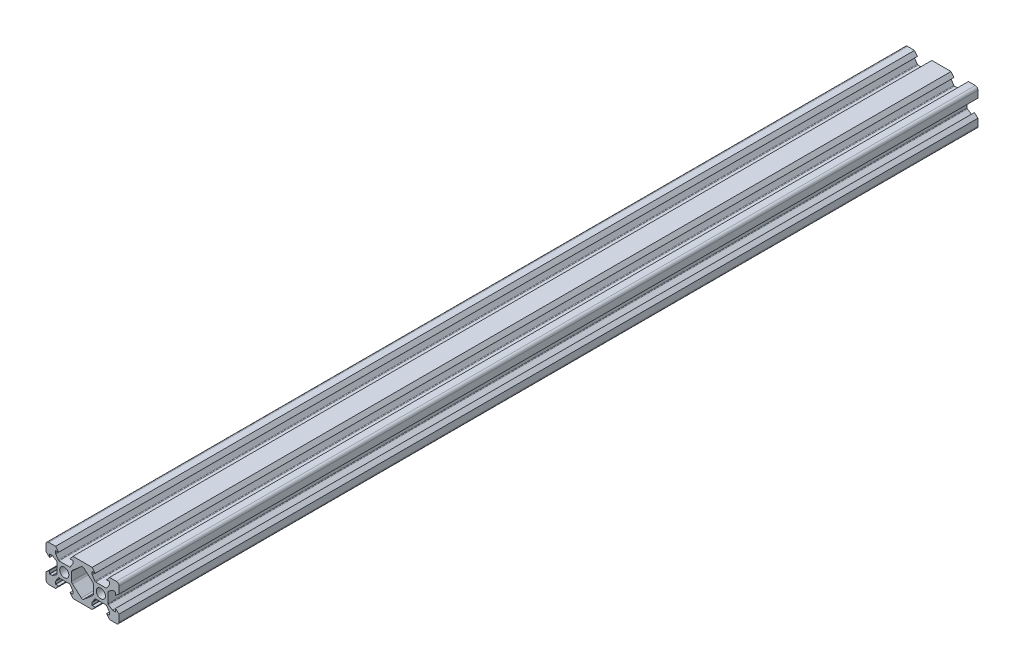
from build123d import *

# Parameters (mm, degrees)
SKETCH_1_R      = 2.5
EXTRUDE_1_DEPTH = 470


with BuildPart() as part:
    # Эскиз1 → Бобышка-Вытянуть1 (new body)
    with BuildSketch(Plane.XY):
        with BuildLine():
            Line((-18.5, 14.076873633), (-14.75, 14.076873633))
            Line((-14.75, 14.076873633), (-13.1, 12.076873633))
            Line((-13.1, 12.076873633), (-14.65, 12.076873633))
            ThreePointArc((-14.65, 12.076873633), (-14.720710678, 12.047584311), (-14.75, 11.976873633))
            Line((-14.75, 11.976873633), (-14.75, 10.726998833))
            ThreePointArc((-14.75, 10.726998833), (-14.728880127, 10.583214884), (-14.667304703, 10.451577729))
            Line((-14.667304703, 10.451577729), (-13.248222071, 8.301452529))
            ThreePointArc((-13.248222071, 8.301452529), (-13.067866147, 8.136583642), (-12.830917368, 8.076873633))
            Line((-12.830917368, 8.076873633), (-7.169082632, 8.076873633))
            ThreePointArc((-7.169082632, 8.076873633), (-6.932133853, 8.136583642), (-6.751777929, 8.301452529))
            Line((-6.751777929, 8.301452529), (-5.332695297, 10.451577729))
            ThreePointArc((-5.332695297, 10.451577729), (-5.271119873, 10.583214884), (-5.25, 10.726998833))
            Line((-5.25, 10.726998833), (-5.25, 11.976873633))
            ThreePointArc((-5.25, 11.976873633), (-5.279289322, 12.047584311), (-5.35, 12.076873633))
            Line((-5.35, 12.076873633), (-6.9, 12.076873633))
            Line((-6.9, 12.076873633), (-5.25, 14.076873633))
            Line((-5.25, 14.076873633), (5.25, 14.076873633))
            Line((5.25, 14.076873633), (6.9, 12.076873633))
            Line((6.9, 12.076873633), (5.35, 12.076873633))
            ThreePointArc((5.35, 12.076873633), (5.279289322, 12.047584311), (5.25, 11.976873633))
            Line((5.25, 11.976873633), (5.25, 10.726998833))
            ThreePointArc((5.25, 10.726998833), (5.271119873, 10.583214884), (5.332695297, 10.451577729))
            Line((5.332695297, 10.451577729), (6.751777929, 8.301452529))
            ThreePointArc((6.751777929, 8.301452529), (6.932133853, 8.136583642), (7.169082632, 8.076873633))
            Line((7.169082632, 8.076873633), (12.830917368, 8.076873633))
            ThreePointArc((12.830917368, 8.076873633), (13.067866147, 8.136583642), (13.248222071, 8.301452529))
            Line((13.248222071, 8.301452529), (14.667304703, 10.451577729))
            ThreePointArc((14.667304703, 10.451577729), (14.728880127, 10.583214884), (14.75, 10.726998833))
            Line((14.75, 10.726998833), (14.75, 11.976873633))
            ThreePointArc((14.75, 11.976873633), (14.720710678, 12.047584311), (14.65, 12.076873633))
            Line((14.65, 12.076873633), (13.1, 12.076873633))
            Line((13.1, 12.076873633), (14.75, 14.076873633))
            Line((14.75, 14.076873633), (18.5, 14.076873633))
            ThreePointArc((18.5, 14.076873633), (19.560660172, 13.637533805), (20, 12.576873633))
            Line((20, 12.576873633), (20, 8.826873633))
            Line((20, 8.826873633), (18, 7.176873633))
            Line((18, 7.176873633), (18, 8.726873633))
            ThreePointArc((18, 8.726873633), (17.970710678, 8.797584311), (17.9, 8.826873633))
            Line((17.9, 8.826873633), (16.6501252, 8.826873633))
            ThreePointArc((16.6501252, 8.826873633), (16.50634125, 8.80575376), (16.374704096, 8.744178337))
            Line((16.374704096, 8.744178337), (14.224578896, 7.325095704))
            ThreePointArc((14.224578896, 7.325095704), (14.059710009, 7.14473978), (14, 6.907791001))
            Line((14, 6.907791001), (14, 1.245956265))
            ThreePointArc((14, 1.245956265), (14.059710009, 1.009007486), (14.224578896, 0.828651562))
            Line((14.224578896, 0.828651562), (16.374704096, -0.59043107))
            ThreePointArc((16.374704096, -0.59043107), (16.50634125, -0.652006494), (16.6501252, -0.673126367))
            Line((16.6501252, -0.673126367), (17.9, -0.673126367))
            ThreePointArc((17.9, -0.673126367), (17.970710678, -0.643837045), (18, -0.573126367))
            Line((18, -0.573126367), (18, 0.976873633))
            Line((18, 0.976873633), (20, -0.673126367))
            Line((20, -0.673126367), (20, -4.423126367))
            ThreePointArc((20, -4.423126367), (19.560660172, -5.483786539), (18.5, -5.923126367))
            Line((18.5, -5.923126367), (14.75, -5.923126367))
            Line((14.75, -5.923126367), (13.1, -3.923126367))
            Line((13.1, -3.923126367), (14.65, -3.923126367))
            ThreePointArc((14.65, -3.923126367), (14.720710678, -3.893837045), (14.75, -3.823126367))
            Line((14.75, -3.823126367), (14.75, -2.573251567))
            ThreePointArc((14.75, -2.573251567), (14.728880127, -2.429467617), (14.667304703, -2.297830463))
            Line((14.667304703, -2.297830463), (13.248222071, -0.147705263))
            ThreePointArc((13.248222071, -0.147705263), (13.067866147, 0.017163624), (12.830917368, 0.076873633))
            Line((12.830917368, 0.076873633), (7.169082632, 0.076873633))
            ThreePointArc((7.169082632, 0.076873633), (6.932133853, 0.017163624), (6.751777929, -0.147705263))
            Line((6.751777929, -0.147705263), (5.332695297, -2.297830463))
            ThreePointArc((5.332695297, -2.297830463), (5.271119873, -2.429467617), (5.25, -2.573251567))
            Line((5.25, -2.573251567), (5.25, -3.823126367))
            ThreePointArc((5.25, -3.823126367), (5.279289322, -3.893837045), (5.35, -3.923126367))
            Line((5.35, -3.923126367), (6.9, -3.923126367))
            Line((6.9, -3.923126367), (5.25, -5.923126367))
            Line((5.25, -5.923126367), (-5.25, -5.923126367))
            Line((-5.25, -5.923126367), (-6.9, -3.923126367))
            Line((-6.9, -3.923126367), (-5.35, -3.923126367))
            ThreePointArc((-5.35, -3.923126367), (-5.279289322, -3.893837045), (-5.25, -3.823126367))
            Line((-5.25, -3.823126367), (-5.25, -2.573251567))
            ThreePointArc((-5.25, -2.573251567), (-5.271119873, -2.429467617), (-5.332695297, -2.297830463))
            Line((-5.332695297, -2.297830463), (-6.751777929, -0.147705263))
            ThreePointArc((-6.751777929, -0.147705263), (-6.932133853, 0.017163624), (-7.169082632, 0.076873633))
            Line((-7.169082632, 0.076873633), (-12.830917368, 0.076873633))
            ThreePointArc((-12.830917368, 0.076873633), (-13.067866147, 0.017163624), (-13.248222071, -0.147705263))
            Line((-13.248222071, -0.147705263), (-14.667304703, -2.297830463))
            ThreePointArc((-14.667304703, -2.297830463), (-14.728880127, -2.429467617), (-14.75, -2.573251567))
            Line((-14.75, -2.573251567), (-14.75, -3.823126367))
            ThreePointArc((-14.75, -3.823126367), (-14.720710678, -3.893837045), (-14.65, -3.923126367))
            Line((-14.65, -3.923126367), (-13.1, -3.923126367))
            Line((-13.1, -3.923126367), (-14.75, -5.923126367))
            Line((-14.75, -5.923126367), (-18.5, -5.923126367))
            ThreePointArc((-18.5, -5.923126367), (-19.560660172, -5.483786539), (-20, -4.423126367))
            Line((-20, -4.423126367), (-20, -0.673126367))
            Line((-20, -0.673126367), (-18, 0.976873633))
            Line((-18, 0.976873633), (-18, -0.573126367))
            ThreePointArc((-18, -0.573126367), (-17.970710678, -0.643837045), (-17.9, -0.673126367))
            Line((-17.9, -0.673126367), (-16.6501252, -0.673126367))
            ThreePointArc((-16.6501252, -0.673126367), (-16.50634125, -0.652006494), (-16.374704096, -0.59043107))
            Line((-16.374704096, -0.59043107), (-14.224578896, 0.828651562))
            ThreePointArc((-14.224578896, 0.828651562), (-14.059710009, 1.009007486), (-14, 1.245956265))
            Line((-14, 1.245956265), (-14, 6.907791001))
            ThreePointArc((-14, 6.907791001), (-14.059710009, 7.14473978), (-14.224578896, 7.325095704))
            Line((-14.224578896, 7.325095704), (-16.374704096, 8.744178337))
            ThreePointArc((-16.374704096, 8.744178337), (-16.50634125, 8.80575376), (-16.6501252, 8.826873633))
            Line((-16.6501252, 8.826873633), (-17.9, 8.826873633))
            ThreePointArc((-17.9, 8.826873633), (-17.970710678, 8.797584311), (-18, 8.726873633))
            Line((-18, 8.726873633), (-18, 7.176873633))
            Line((-18, 7.176873633), (-20, 8.826873633))
            Line((-20, 8.826873633), (-20, 12.576873633))
            ThreePointArc((-20, 12.576873633), (-19.560660172, 13.637533805), (-18.5, 14.076873633))
        make_face()
        with Locations((-10, 4.076873633)):
            Circle(SKETCH_1_R, mode=Mode.SUBTRACT)
        with Locations((10, 4.076873633)):
            Circle(SKETCH_1_R, mode=Mode.SUBTRACT)
        with BuildLine():
            Line((-6, 6.220171901), (-6, 1.933575365))
            ThreePointArc((-6, 1.933575365), (-5.863556224, 1.30850383), (-5.479047434, 0.797148455))
            Line((-5.479047434, 0.797148455), (-0.652698289, -3.360817802))
            ThreePointArc((-0.652698289, -3.360817802), (0, -3.603199861), (0.652698289, -3.360817802))
            Line((0.652698289, -3.360817802), (5.479047434, 0.797148455))
            ThreePointArc((5.479047434, 0.797148455), (5.863556224, 1.30850383), (6, 1.933575365))
            Line((6, 1.933575365), (6, 6.220171901))
            ThreePointArc((6, 6.220171901), (5.863556224, 6.845243437), (5.479047434, 7.356598811))
            Line((5.479047434, 7.356598811), (0.652698289, 11.514565068))
            ThreePointArc((0.652698289, 11.514565068), (0, 11.756947128), (-0.652698289, 11.514565068))
            Line((-0.652698289, 11.514565068), (-5.479047434, 7.356598811))
            ThreePointArc((-5.479047434, 7.356598811), (-5.863556224, 6.845243437), (-6, 6.220171901))
        make_face(mode=Mode.SUBTRACT)
    extrude(amount=-EXTRUDE_1_DEPTH)


solid = part.part
